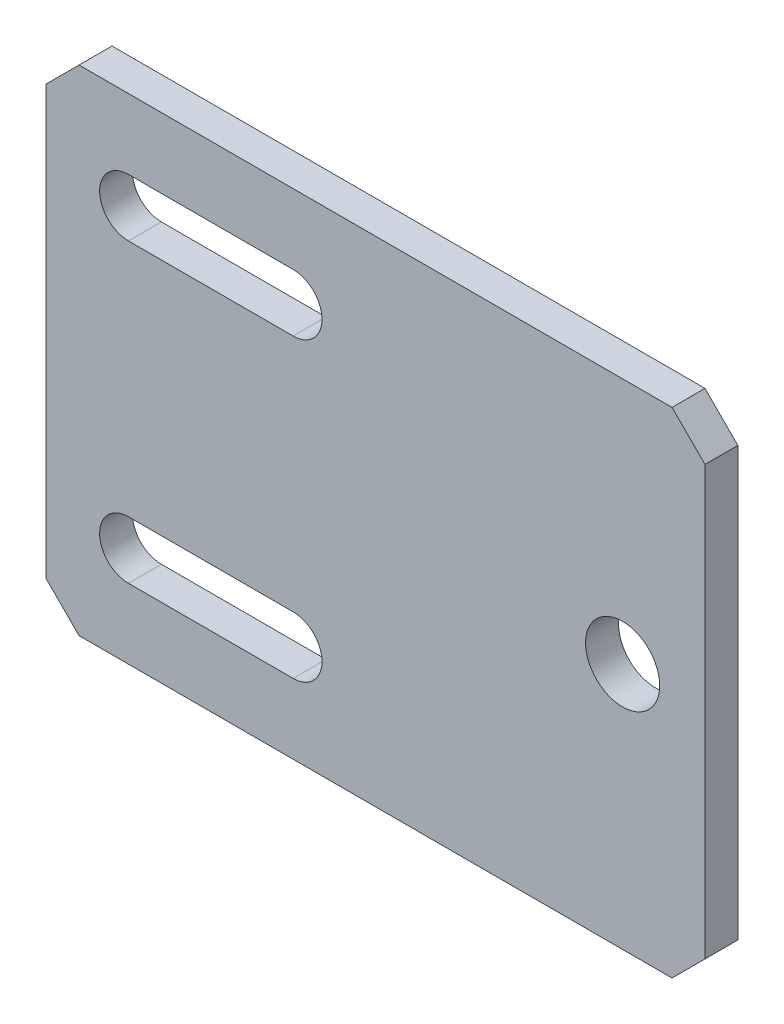
from build123d import *

# Parameters (mm, degrees)
SKETCH1_W            = 40
SKETCH1_H            = 30
BOSS_EXTRUDE1_DEPTH  = 2
CHAMFER1_SIZE        = 2
N_CUT_EXTRUDE1_DEPTH = 51.039984013
N_CUT_EXTRUDE2_DEPTH = 51.039984013
D_DIAMETER_HOLE1_D   = 4.5


with BuildPart() as part:
    # Sketch1 → Boss-Extrude1 (new body)
    with BuildSketch(Plane.XY):
        with Locations((20, 15)):
            Rectangle(SKETCH1_W, SKETCH1_H)
    extrude(amount=BOSS_EXTRUDE1_DEPTH)

    # Chamfer1
    chamfer1_edges = [part.edges().sort_by_distance(p)[0] for p in [
        (40, 0, 1),
        (0, 0, 1),
        (40, 30, 1),
        (0, 30, 1),
    ]]
    chamfer(chamfer1_edges, length=CHAMFER1_SIZE)

    # Sketch2 → N Cut-Extrude1 (cut, through all)
    with BuildSketch(Plane.XY.offset(2)):
        with BuildLine():
            Line((5, 7.75), (15, 7.75))
            ThreePointArc((15, 7.75), (16.75, 6), (15, 4.25))
            Line((15, 4.25), (5, 4.25))
            ThreePointArc((5, 4.25), (3.25, 6), (5, 7.75))
        make_face()
    extrude(amount=-N_CUT_EXTRUDE1_DEPTH, mode=Mode.SUBTRACT)

    # Sketch3 → N Cut-Extrude2 (cut, through all)
    with BuildSketch(Plane.XY.offset(2)):
        with BuildLine():
            Line((5, 25.75), (15, 25.75))
            ThreePointArc((15, 25.75), (16.75, 24), (15, 22.25))
            Line((15, 22.25), (5, 22.25))
            ThreePointArc((5, 22.25), (3.25, 24), (5, 25.75))
        make_face()
    extrude(amount=-N_CUT_EXTRUDE2_DEPTH, mode=Mode.SUBTRACT)

    # D Diameter Hole1 (through all)
    with Locations(Plane.XY.offset(2)):
        with Locations((35, 15)):
            Hole(D_DIAMETER_HOLE1_D / 2)


solid = part.part
